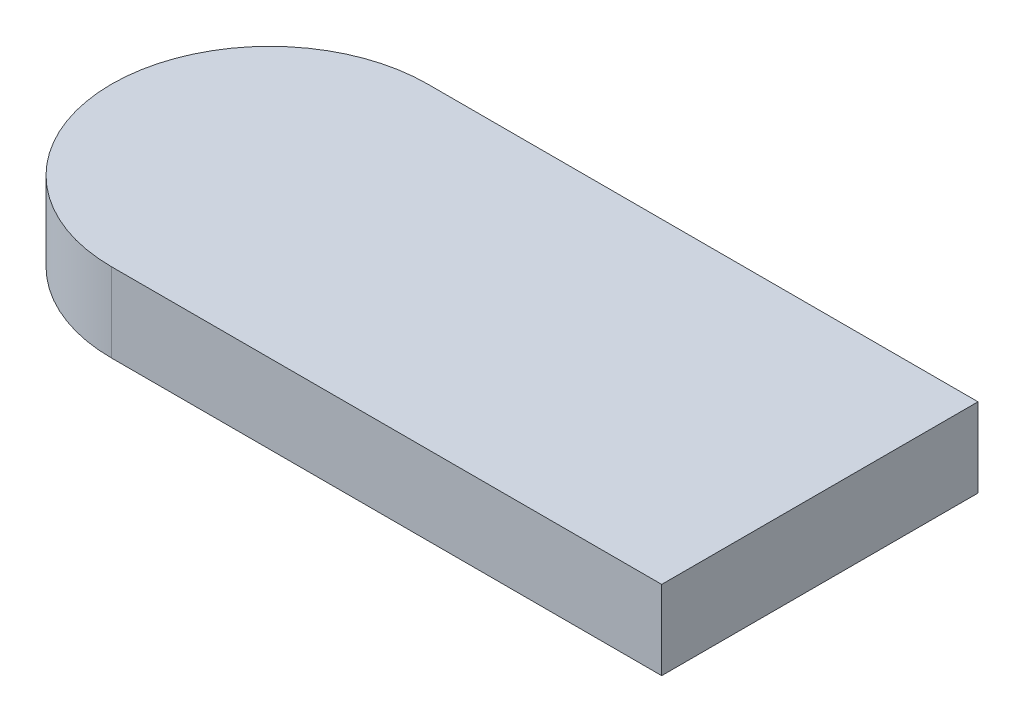
from build123d import *

# Parameters (mm, degrees)
EXTRUDE_1_DEPTH = 5.97


with BuildPart() as part:
    # 스케치1 → 보스-돌출1 (new body)
    with BuildSketch(Plane(origin=(0, 0, 0), x_dir=(1, 0, 0), z_dir=(0, 1, 0))):
        with BuildLine():
            Line((-20.77, -11.94), (20.77, -11.94))
            Line((20.77, -11.94), (20.77, 11.94))
            Line((20.77, 11.94), (-20.77, 11.94))
            ThreePointArc((-20.77, 11.94), (-32.71, 0), (-20.77, -11.94))
        make_face()
    extrude(amount=EXTRUDE_1_DEPTH)


solid = part.part
